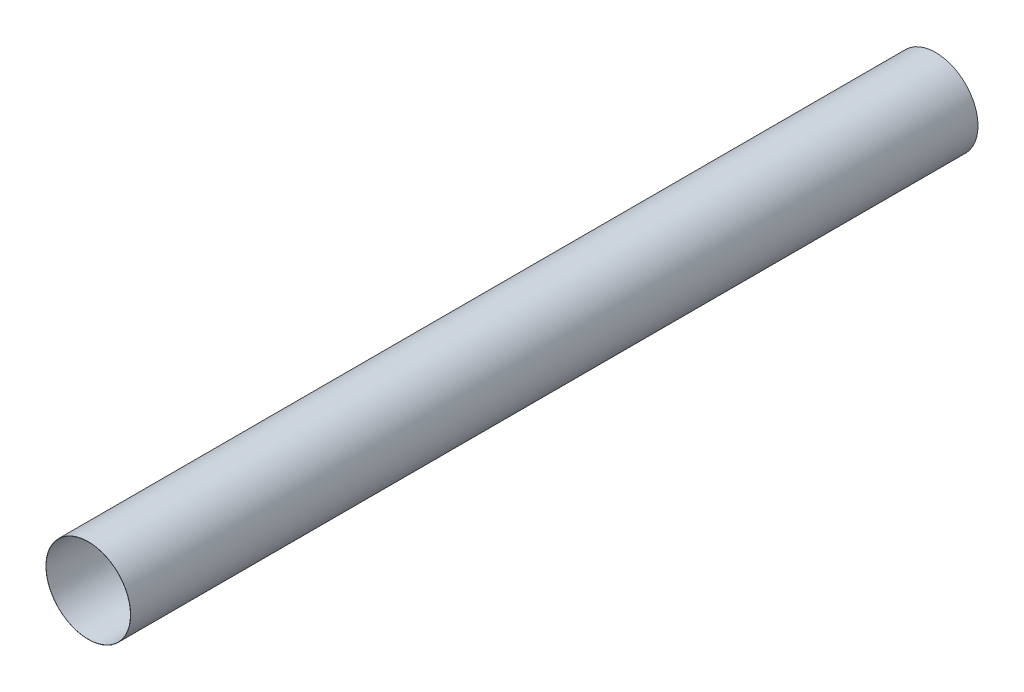
from build123d import *

# Parameters (mm, degrees)
SKETCH2_R           = 500
SKETCH2_R_2         = 498
BOSS_EXTRUDE1_DEPTH = 10000


with BuildPart() as part:
    # Sketch2 → Boss-Extrude1 (new body)
    with BuildSketch(Plane.XY):
        Circle(SKETCH2_R)
        Circle(SKETCH2_R_2, mode=Mode.SUBTRACT)
    extrude(amount=BOSS_EXTRUDE1_DEPTH)


solid = part.part
